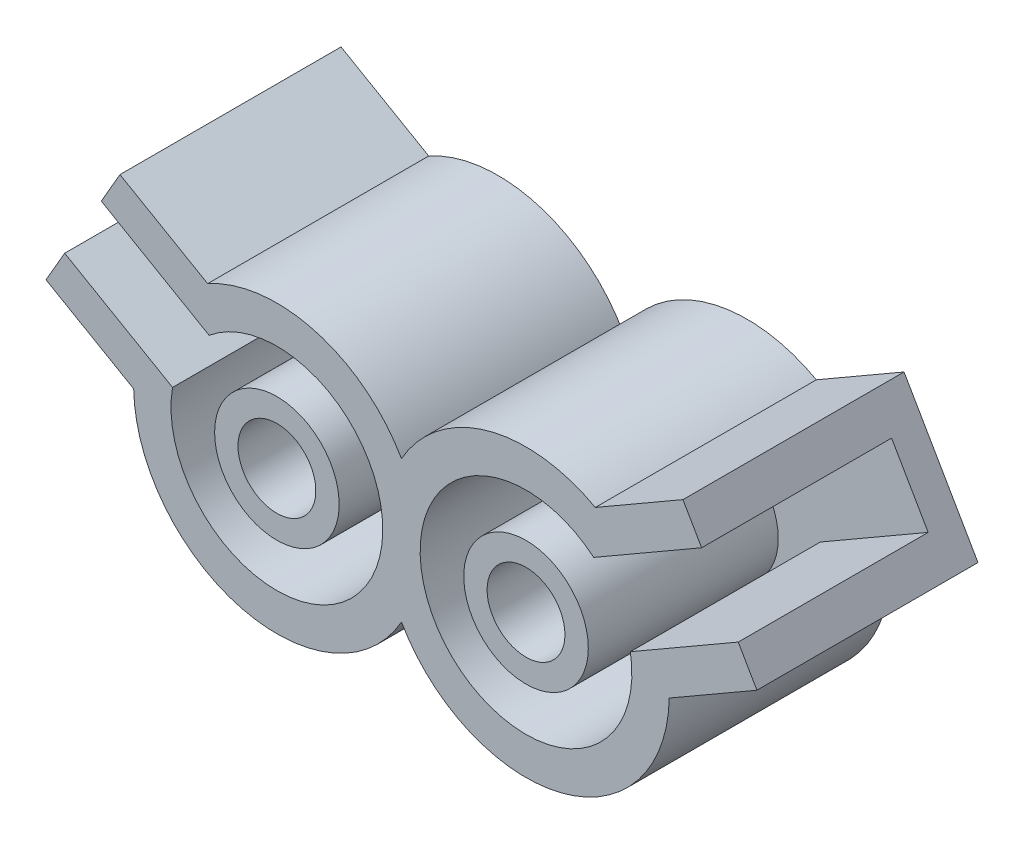
from build123d import *

# Parameters (mm, degrees)
SKETCH1_R             = 2
SKETCH1_R_2           = 1.25
BOSS_EXTRUDE1_DEPTH   = 6.1
BOSS_EXTRUDE1_2_DEPTH = 6.1
BOSS_EXTRUDE1_3_DEPTH = 6.1
BOSS_EXTRUDE2_DEPTH   = 1
CUT_EXTRUDE1_REACH    = 18.114
SKETCH6_R             = 1.25


with BuildPart() as part:
    # Sketch1 → Boss-Extrude1 (new body)
    with BuildSketch(Plane.XY):
        with Locations((4, 3.947606604)):
            Circle(SKETCH1_R)
        with Locations((4, 3.947606604)):
            Circle(SKETCH1_R_2, mode=Mode.SUBTRACT)
    extrude(amount=BOSS_EXTRUDE1_DEPTH)



with BuildPart() as body_2:
    # Sketch1 → Boss-Extrude1 2 (new body)
    with BuildSketch(Plane.XY):
        with Locations(Location((-4, 3.947606604, 0), (0, 0, 180))):
            Circle(SKETCH1_R)
        with Locations(Location((-4, 3.947606604, 0), (0, 0, 180))):
            Circle(SKETCH1_R_2, mode=Mode.SUBTRACT)
    extrude(amount=BOSS_EXTRUDE1_2_DEPTH)


with BuildPart() as body_3:
    # Sketch1 → Boss-Extrude1 3 (new body)
    with BuildSketch(Plane.XY):
        with BuildLine():
            Line((7.350565553, 4.525283395), (10.814667168, 6.525283395))
            Line((10.814667168, 6.525283395), (11.414667168, 5.486052911))
            Line((11.414667168, 5.486052911), (8.599175725, 3.860528168))
            ThreePointArc((8.599175725, 3.860528168), (5.132583975, -0.510784758), (0, 1.676043266))
            ThreePointArc((0, 1.676043266), (-5.132583975, -0.510784758), (-8.599175725, 3.860528168))
            Line((-8.599175725, 3.860528168), (-11.414667168, 5.486052911))
            Line((-11.414667168, 5.486052911), (-10.814667168, 6.525283395))
            Line((-10.814667168, 6.525283395), (-7.350565553, 4.525283395))
            ThreePointArc((-7.350565553, 4.525283395), (-1.055513627, 2.247606604), (-6.175565553, 6.560443094))
            Line((-6.175565553, 6.560443094), (-9.639667168, 8.560443094))
            Line((-9.639667168, 8.560443094), (-9.039667168, 9.599673579))
            Line((-9.039667168, 9.599673579), (-6.224175725, 7.974148836))
            ThreePointArc((-6.224175725, 7.974148836), (-2.751650813, 8.374978771), (0, 6.219169942))
            ThreePointArc((0, 6.219169942), (2.751650813, 8.374978771), (6.224175725, 7.974148836))
            Line((6.224175725, 7.974148836), (9.039667168, 9.599673579))
            Line((9.039667168, 9.599673579), (9.639667168, 8.560443094))
            Line((9.639667168, 8.560443094), (6.175565553, 6.560443094))
            ThreePointArc((6.175565553, 6.560443094), (1.055513627, 2.247606604), (7.350565553, 4.525283395))
        make_face()
    extrude(amount=BOSS_EXTRUDE1_3_DEPTH)


with BuildPart() as part_1:
    add(part.part)

    add(body_2.part)  # Boss-Extrude2 merges body 2

    add(body_3.part)  # Boss-Extrude2 merges body 3
    # Sketch2 → Boss-Extrude2 (add)
    with BuildSketch(Plane(origin=(0, 0, 0), x_dir=(-1, 0, 0), z_dir=(0, 0, -1))):
        with BuildLine():
            Line((-9.639667168, 8.560443094), (-10.814667168, 6.525283395))
            Line((-10.814667168, 6.525283395), (-11.414667168, 5.486052911))
            Line((-11.414667168, 5.486052911), (-8.599175725, 3.860528168))
            ThreePointArc((-8.599175725, 3.860528168), (-5.132583975, -0.510784758), (0, 1.676043266))
            ThreePointArc((0, 1.676043266), (5.132583975, -0.510784758), (8.599175725, 3.860528168))
            Line((8.599175725, 3.860528168), (11.414667168, 5.486052911))
            Line((11.414667168, 5.486052911), (10.814667168, 6.525283395))
            Line((10.814667168, 6.525283395), (9.639667168, 8.560443094))
            Line((9.639667168, 8.560443094), (9.039667168, 9.599673579))
            Line((9.039667168, 9.599673579), (6.224175725, 7.974148836))
            ThreePointArc((6.224175725, 7.974148836), (2.751650813, 8.374978771), (0, 6.219169942))
            ThreePointArc((0, 6.219169942), (-2.751650813, 8.374978771), (-6.224175725, 7.974148836))
            Line((-6.224175725, 7.974148836), (-9.039667168, 9.599673579))
            Line((-9.039667168, 9.599673579), (-9.639667168, 8.560443094))
        make_face()
    extrude(amount=BOSS_EXTRUDE2_DEPTH)

    # Sketch6 → Cut-Extrude1 (cut, up to next)
    with BuildSketch(Plane.XY, mode=Mode.PRIVATE) as cut_extrude1_sk1:
        with Locations(Location((4, 3.947606604, 0), (0, 0, 180))):
            Circle(SKETCH6_R)
    cut_extrude1_tool1 = extrude(cut_extrude1_sk1.sketch, amount=-CUT_EXTRUDE1_REACH, mode=Mode.PRIVATE) & part_1.part
    # Sketch6 → Cut-Extrude1 (cut, up to next)
    with BuildSketch(Plane.XY, mode=Mode.PRIVATE) as cut_extrude1_sk2:
        with Locations(Location((-4, 3.947606604, 0), (0, 0, 180))):
            Circle(SKETCH6_R)
    cut_extrude1_tool2 = extrude(cut_extrude1_sk2.sketch, amount=-CUT_EXTRUDE1_REACH, mode=Mode.PRIVATE) & part_1.part
    add(cut_extrude1_tool1.solids().sort_by_distance((4, 3.947607, 0))[0], mode=Mode.SUBTRACT)
    add(cut_extrude1_tool2.solids().sort_by_distance((-4, 3.947607, 0))[0], mode=Mode.SUBTRACT)


solid = part_1.part
